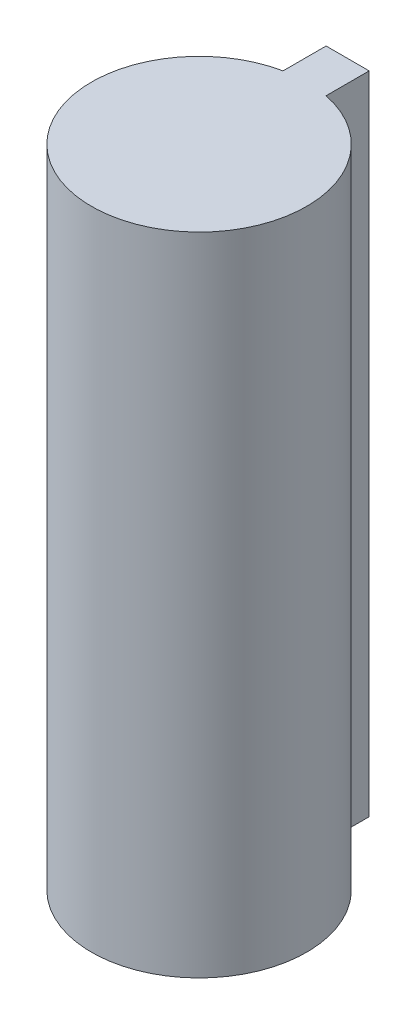
from build123d import *

# Parameters (mm, degrees)
EXTRUDE_1_DEPTH = 60


with BuildPart() as part:
    # 草图1 → 凸台-拉伸1 (new body)
    with BuildSketch(Plane(origin=(0, 0, 0), x_dir=(1, 0, 0), z_dir=(0, 1, 0))):
        with BuildLine():
            Line((-2, 9.797958971), (-2, 13.797958971))
            Line((-2, 13.797958971), (2, 13.797958971))
            Line((2, 13.797958971), (2, 9.797958971))
            ThreePointArc((2, 9.797958971), (0, -10), (-2, 9.797958971))
        make_face()
    extrude(amount=EXTRUDE_1_DEPTH)


solid = part.part
